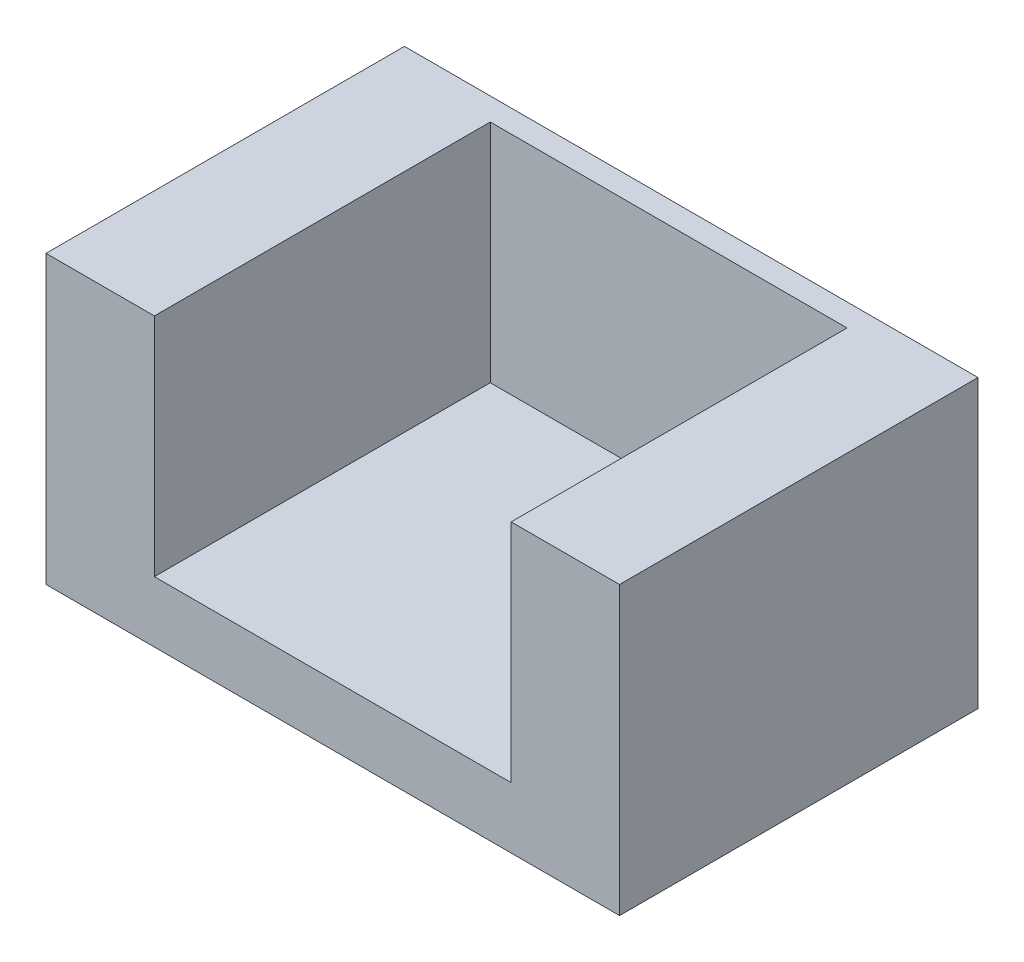
from build123d import *

# Parameters (mm, degrees)
SKETCH1_W           = 25.4
SKETCH1_H           = 15.875
BOSS_EXTRUDE1_DEPTH = 12.7
SKETCH2_W           = 15.8
SKETCH2_H           = 14.875
CUT_EXTRUDE1_DEPTH  = 10


with BuildPart() as part:
    # Sketch1 → Boss-Extrude1 (new body)
    with BuildSketch(Plane(origin=(0, 0, 0), x_dir=(1, 0, 0), z_dir=(0, 1, 0))):
        with Locations((-6.393120273, -1.960690549)):
            Rectangle(SKETCH1_W, SKETCH1_H)
    extrude(amount=BOSS_EXTRUDE1_DEPTH)

    # Sketch2 → Cut-Extrude1 (cut)
    with BuildSketch(Plane(origin=(0, 12.7, 0), x_dir=(1, 0, 0), z_dir=(0, 1, 0))):
        with Locations((-6.393120273, -2.460690549)):
            Rectangle(SKETCH2_W, SKETCH2_H)
    extrude(amount=-CUT_EXTRUDE1_DEPTH, mode=Mode.SUBTRACT)


solid = part.part
